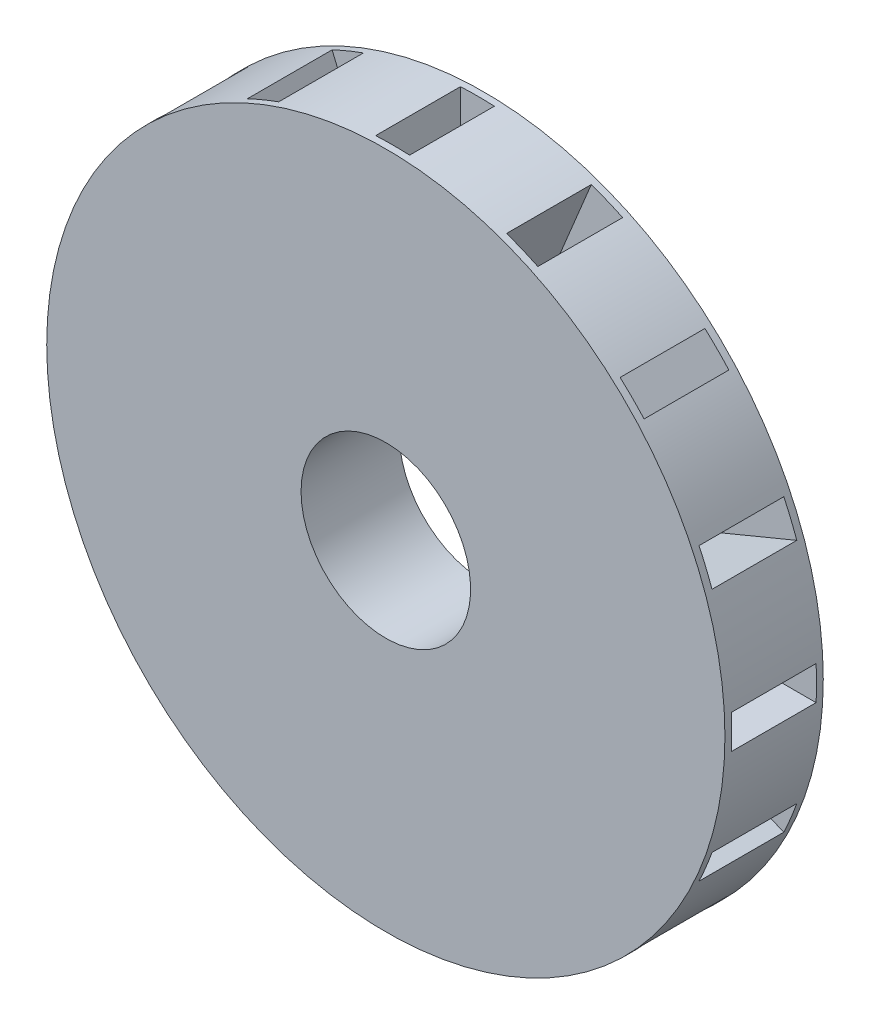
from build123d import *

# Parameters (mm, degrees)
SKETCH1_R           = 100
SKETCH1_R_2         = 25
BOSS_EXTRUDE1_DEPTH = 14.5
CUT_EXTRUDE1_DEPTH  = 12.5


with BuildPart() as part:
    # Sketch1 → Boss-Extrude1 (new, symmetric)
    with BuildSketch(Plane.XY):
        with Locations(Location((0, 0, 0), (0, 0, 180))):
            Circle(SKETCH1_R)
        with Locations(Location((0, 0, 0), (0, 0, 180))):
            Circle(SKETCH1_R_2, mode=Mode.SUBTRACT)
    extrude(amount=BOSS_EXTRUDE1_DEPTH, both=True)

    # Sketch2 → Cut-Extrude1 (cut, symmetric)
    with BuildSketch(Plane.XY):
        Polygon((100, 5), (110, -5), (100, -5), (60, -5), (60, 5), align=None)
        Polygon((57.346189113, -18.341608279), (94.301370413, -33.648945574), (99.713331414, -46.714575223), (90.474536089, -42.887740899), (53.519354789, -27.580403604), align=None)
        Polygon((45.961940777, -38.890872965), (74.246212025, -67.175144213), (74.246212025, -81.317279836), (67.175144213, -74.246212025), (38.890872965, -45.961940777), align=None)
        Polygon((27.580403604, -53.519354789), (42.887740899, -90.474536089), (37.475779898, -103.540165738), (33.648945574, -94.301370413), (18.341608279, -57.346189113), align=None)
        Polygon((5, -60), (5, -100), (-5, -110), (-5, -100), (-5, -60), align=None)
        Polygon((-18.341608279, -57.346189113), (-33.648945574, -94.301370413), (-46.714575223, -99.713331414), (-42.887740899, -90.474536089), (-27.580403604, -53.519354789), align=None)
        Polygon((-38.890872965, -45.961940777), (-67.175144213, -74.246212025), (-81.317279836, -74.246212025), (-74.246212025, -67.175144213), (-45.961940777, -38.890872965), align=None)
        Polygon((-53.519354789, -27.580403604), (-90.474536089, -42.887740899), (-103.540165738, -37.475779898), (-94.301370413, -33.648945574), (-57.346189113, -18.341608279), align=None)
        Polygon((-60, -5), (-100, -5), (-110, 5), (-100, 5), (-60, 5), align=None)
        Polygon((-57.346189113, 18.341608279), (-94.301370413, 33.648945574), (-99.713331414, 46.714575223), (-90.474536089, 42.887740899), (-53.519354789, 27.580403604), align=None)
        Polygon((-45.961940777, 38.890872965), (-74.246212025, 67.175144213), (-74.246212025, 81.317279836), (-67.175144213, 74.246212025), (-38.890872965, 45.961940777), align=None)
        Polygon((-27.580403604, 53.519354789), (-42.887740899, 90.474536089), (-37.475779898, 103.540165738), (-33.648945574, 94.301370413), (-18.341608279, 57.346189113), align=None)
        Polygon((-5, 60), (-5, 100), (5, 110), (5, 100), (5, 60), align=None)
        Polygon((18.341608279, 57.346189113), (33.648945574, 94.301370413), (46.714575223, 99.713331414), (42.887740899, 90.474536089), (27.580403604, 53.519354789), align=None)
        Polygon((38.890872965, 45.961940777), (67.175144213, 74.246212025), (81.317279836, 74.246212025), (74.246212025, 67.175144213), (45.961940777, 38.890872965), align=None)
        Polygon((53.519354789, 27.580403604), (90.474536089, 42.887740899), (103.540165738, 37.475779898), (94.301370413, 33.648945574), (57.346189113, 18.341608279), align=None)
    extrude(amount=CUT_EXTRUDE1_DEPTH, both=True, mode=Mode.SUBTRACT)


solid = part.part
